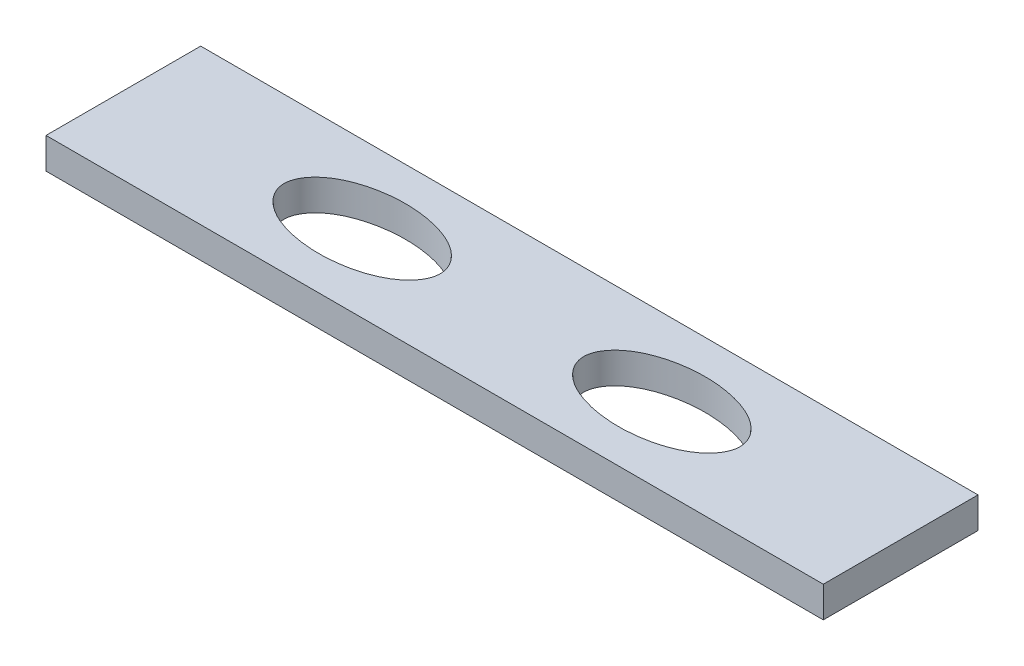
from build123d import *

# Parameters (mm, degrees)
SKETCH1_W           = 50.25
SKETCH1_H           = 10
BOSS_EXTRUDE1_DEPTH = 2


with BuildPart() as part:
    # Sketch1 → Boss-Extrude1 (new body)
    with BuildSketch(Plane(origin=(0, 0, 0), x_dir=(1, 0, 0), z_dir=(0, 1, 0))):
        with Locations((-13.079545455, 1.78030303)):
            Rectangle(SKETCH1_W, SKETCH1_H)
        with BuildLine():
            add(Edge.make_bspline(
                [(-27.815545455, 1.78030303), (-27.815545455, 1.044100491), (-26.703482329, -0.428304587), (-22.765545455, -1.315393161), (-18.82760858, -0.428304587), (-17.159513892, 1.78030303), (-18.82760858, 3.988910648), (-22.765545455, 4.875999221), (-26.703482329, 3.988910648), (-27.815545455, 2.51650557), (-27.815545455, 1.78030303)],
                knots=[0, 0, 0, 0, 0.785398163, 1.570796327, 2.35619449, 3.141592654, 3.926990817, 4.71238898, 5.497787144, 6.283185307, 6.283185307, 6.283185307, 6.283185307], degree=3))
        make_face(mode=Mode.SUBTRACT)
        with BuildLine():
            add(Edge.make_bspline(
                [(-8.443545455, 1.78030303), (-8.443545455, 1.044100491), (-7.331482329, -0.428304587), (-3.393545455, -1.315393161), (0.54439142, -0.428304587), (2.212486108, 1.78030303), (0.54439142, 3.988910648), (-3.393545455, 4.875999221), (-7.331482329, 3.988910648), (-8.443545455, 2.51650557), (-8.443545455, 1.78030303)],
                knots=[0, 0, 0, 0, 0.785398163, 1.570796327, 2.35619449, 3.141592654, 3.926990817, 4.71238898, 5.497787144, 6.283185307, 6.283185307, 6.283185307, 6.283185307], degree=3))
        make_face(mode=Mode.SUBTRACT)
    extrude(amount=BOSS_EXTRUDE1_DEPTH)


solid = part.part
